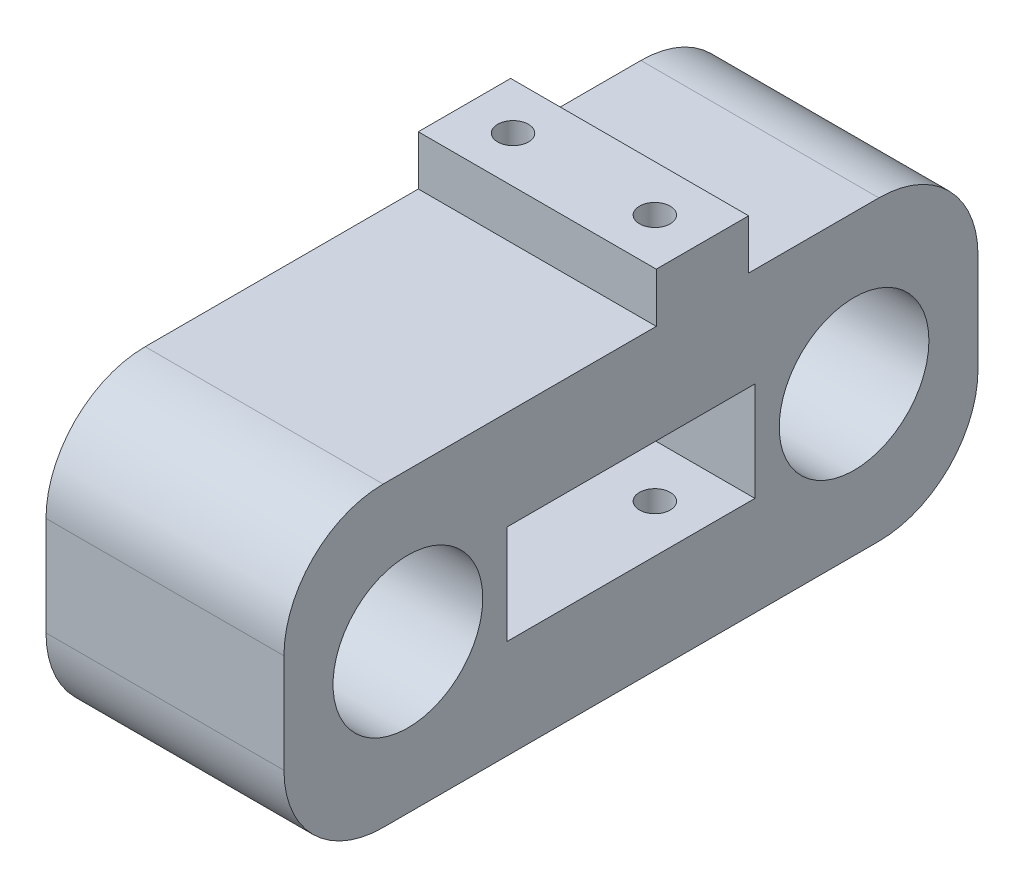
from build123d import *

# Parameters (mm, degrees)
SKETCH_1_W          = 24
SKETCH_1_H          = 70
EXTRUDE_1_DEPTH     = 30
SKETCH_2_R          = 7.55
CUT_EXTRUDE_1_DEPTH = 71.806439045
SKETCH_3_W          = 25
SKETCH_3_H          = 10
CUT_EXTRUDE_2_DEPTH = 71.806439045
SKETCH_4_W          = 24
SKETCH_4_H          = 9.317438099
EXTRUDE_2_DEPTH     = 5
SKETCH_5_R          = 1.55
CUT_EXTRUDE_3_DEPTH = 31
FILLET_1_R          = 10


with BuildPart() as part:
    # 草图1 → 凸台-拉伸1 (new body)
    with BuildSketch(Plane(origin=(0, 0, 0), x_dir=(1, 0, 0), z_dir=(0, 1, 0))):
        with Locations((20.241900648, -24.477321814)):
            Rectangle(SKETCH_1_W, SKETCH_1_H)
    extrude(amount=EXTRUDE_1_DEPTH)

    # 草图2 → 切除-拉伸1 (cut, through all)
    with BuildSketch(Plane(origin=(32.241900648, 0, 0), x_dir=(0, 0, -1), z_dir=(1, 0, 0))):
        with Locations((-46.977321814, 15)):
            Circle(SKETCH_2_R)
        with Locations((-1.977321814, 15)):
            Circle(SKETCH_2_R)
    extrude(amount=-CUT_EXTRUDE_1_DEPTH, mode=Mode.SUBTRACT)

    # 草图3 → 切除-拉伸2 (cut, through all)
    with BuildSketch(Plane(origin=(32.241900648, 0, 0), x_dir=(0, 0, -1), z_dir=(1, 0, 0))):
        with Locations((-24.477321814, 15)):
            Rectangle(SKETCH_3_W, SKETCH_3_H)
    extrude(amount=-CUT_EXTRUDE_2_DEPTH, mode=Mode.SUBTRACT)

    # 草图4 → 凸台-拉伸2 (add)
    with BuildSketch(Plane(origin=(0, 30, 0), x_dir=(1, 0, 0), z_dir=(0, 1, 0))):
        with Locations((20.241900648, -17.269567559)):
            Rectangle(SKETCH_4_W, SKETCH_4_H)
    extrude(amount=EXTRUDE_2_DEPTH)

    # 草图5 → 切除-拉伸3 (cut)
    with BuildSketch(Plane(origin=(0, 35, 0), x_dir=(1, 0, 0), z_dir=(0, 1, 0))):
        with Locations(Location((27.441174565, -17.269567558, 0), (0, 0, 270))):
            Circle(SKETCH_5_R)
        with Locations(Location((13.141174565, -17.269567558, 0), (0, 0, 270))):
            Circle(SKETCH_5_R)
    extrude(amount=-CUT_EXTRUDE_3_DEPTH, mode=Mode.SUBTRACT)

    # 圆角1
    fillet_1_edges = [part.edges().sort_by_distance(p)[0] for p in [
        (20.241900648, 30, -10.522678186),
        (20.241900648, 0, -10.522678186),
        (20.241900648, 0, 59.477321814),
        (20.241900648, 30, 59.477321814),
    ]]
    fillet(fillet_1_edges, radius=FILLET_1_R)


solid = part.part
